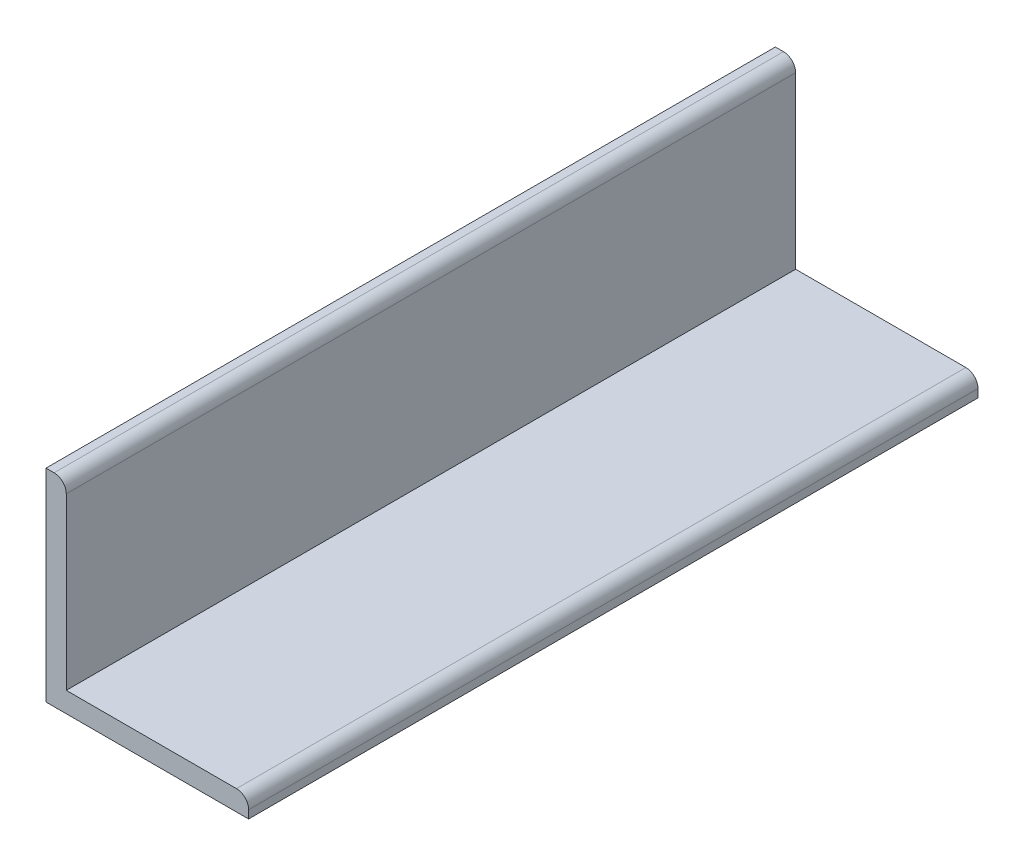
from build123d import *

# Parameters (mm, degrees)
BOSS_EXTRUDE1_DEPTH = 90


with BuildPart() as part:
    # Sketch1 → Boss-Extrude1 (new, symmetric)
    with BuildSketch(Plane.XY):
        with BuildLine():
            Line((-20, 22), (-20, -20))
            Line((-20, -20), (22, -20))
            ThreePointArc((22, -20), (24.121320344, -20.878679656), (25, -23))
            Line((25, -23), (25, -25))
            Line((25, -25), (-25, -25))
            Line((-25, -25), (-25, 25))
            Line((-25, 25), (-23, 25))
            ThreePointArc((-23, 25), (-20.878679656, 24.121320344), (-20, 22))
        make_face()
    extrude(amount=BOSS_EXTRUDE1_DEPTH, both=True)


solid = part.part
